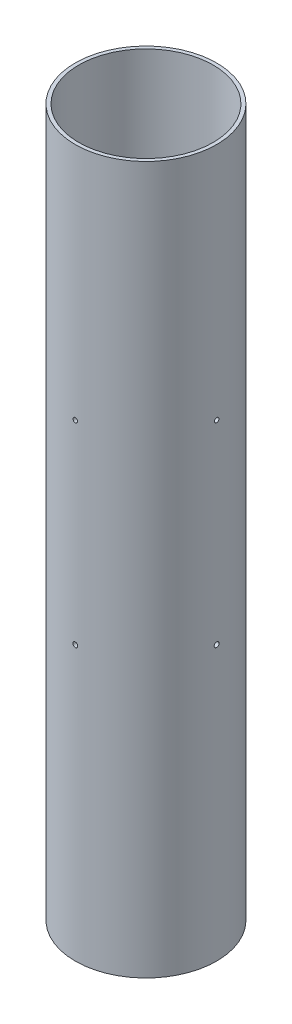
from build123d import *

# Parameters (mm, degrees)
SKETCH1_R                = 50.8
SKETCH1_R_2              = 48.26
COUPLER_EXTRUSION_DEPTH  = 508
BULKHEAD_HOLE_REACH      = 522.545
BULKHEAD_HOLE_END_RADIUS = 48.26
SKETCH2_R                = 1.6383
CIRPATTERN1_COUNT        = 4
CUT_EXTRUDE1_REACH       = 522.545
CUT_EXTRUDE1_END_RADIUS  = 48.26
SKETCH3_R                = 1.7526
CIRPATTERN2_COUNT        = 4


with BuildPart() as part:
    # Sketch1 → Coupler Extrusion (new body)
    with BuildSketch(Plane(origin=(0, 0, 0), x_dir=(1, 0, 0), z_dir=(0, 1, 0))):
        Circle(SKETCH1_R)
        Circle(SKETCH1_R_2, mode=Mode.SUBTRACT)
    extrude(amount=COUPLER_EXTRUSION_DEPTH)

    # Bulkhead Hole: up to this cylinder (the profile starts outside it)
    bulkhead_hole_end = Plane(origin=(0, 336.55, 0), z_dir=(0, -1, 0)) * Cylinder(BULKHEAD_HOLE_END_RADIUS, 1142.61, mode=Mode.PRIVATE)
    # Sketch2 → Bulkhead Hole (cut, up to the surface)
    with BuildSketch(Plane.XY.offset(50.8), mode=Mode.PRIVATE) as bulkhead_hole_sk1:
        with Locations((0, 336.55)):
            Circle(SKETCH2_R)
    bulkhead_hole_tool1 = extrude(bulkhead_hole_sk1.sketch, amount=-BULKHEAD_HOLE_REACH, mode=Mode.PRIVATE) - bulkhead_hole_end
    bulkhead_hole = bulkhead_hole_tool1.solids().sort_by_distance((0, 336.55, 50.8))[0]
    add(bulkhead_hole, mode=Mode.SUBTRACT)

    # CirPattern1: Bulkhead Hole ×4 about axis
    cirpattern1_axis = Axis((0, 508, 0), (0, -1, 0))
    for i in range(1, CIRPATTERN1_COUNT):
        add(bulkhead_hole.rotate(cirpattern1_axis, i * 360 / CIRPATTERN1_COUNT), mode=Mode.SUBTRACT)

    # Cut-Extrude1: up to this cylinder (the profile starts outside it)
    cut_extrude1_end = Plane(origin=(0, 196.85, 0), z_dir=(0, -1, 0)) * Cylinder(CUT_EXTRUDE1_END_RADIUS, 1142.61, mode=Mode.PRIVATE)
    # Sketch3 → Cut-Extrude1 (cut, up to the surface)
    with BuildSketch(Plane.XY.offset(50.8), mode=Mode.PRIVATE) as cut_extrude1_sk1:
        with Locations((0, 196.85)):
            Circle(SKETCH3_R)
    cut_extrude1_tool1 = extrude(cut_extrude1_sk1.sketch, amount=-CUT_EXTRUDE1_REACH, mode=Mode.PRIVATE) - cut_extrude1_end
    cut_extrude1 = cut_extrude1_tool1.solids().sort_by_distance((0, 196.85, 50.8))[0]
    add(cut_extrude1, mode=Mode.SUBTRACT)

    # CirPattern2: Cut-Extrude1 ×4 about axis
    cirpattern2_axis = Axis((0, 508, 0), (0, -1, 0))
    for i in range(1, CIRPATTERN2_COUNT):
        add(cut_extrude1.rotate(cirpattern2_axis, i * 360 / CIRPATTERN2_COUNT), mode=Mode.SUBTRACT)


solid = part.part
